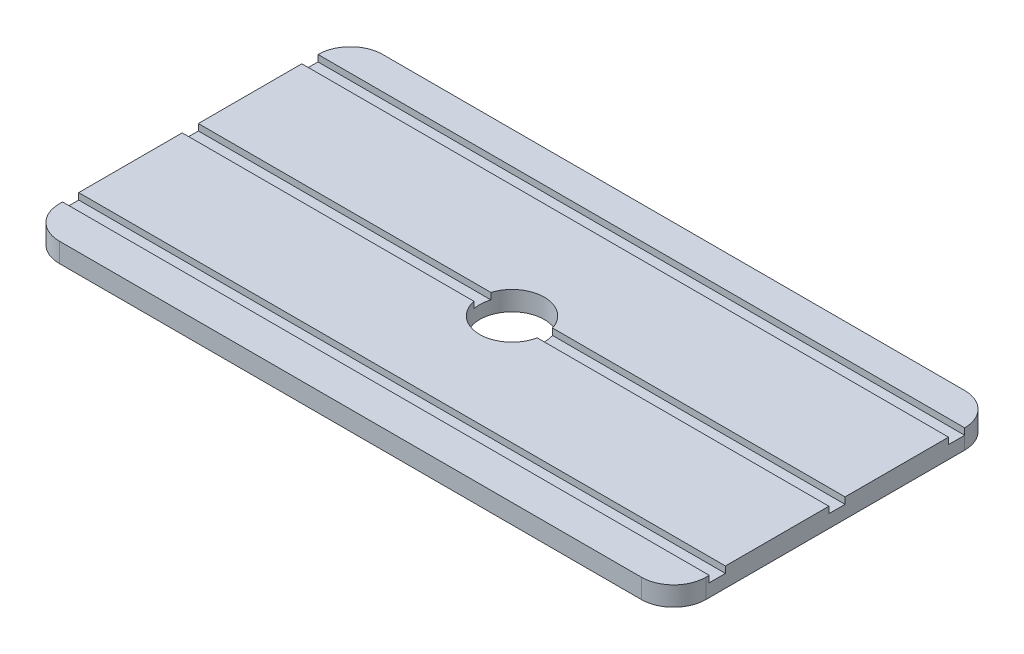
from build123d import *

# Parameters (mm, degrees)
SKETCH1_W           = 100
SKETCH1_H           = 50
BOSS_EXTRUDE1_DEPTH = 3
FILLET1_R           = 5
SKETCH2_R           = 5
CUT_EXTRUDE1_DEPTH  = 3
SKETCH4_W           = 100
SKETCH4_H           = 2.5
CUT_EXTRUDE2_DEPTH  = 1


with BuildPart() as part:
    # Sketch1 → Boss-Extrude1 (new body)
    with BuildSketch(Plane(origin=(0, 0, 0), x_dir=(1, 0, 0), z_dir=(0, 1, 0))):
        Rectangle(SKETCH1_W, SKETCH1_H)
    extrude(amount=BOSS_EXTRUDE1_DEPTH)

    # Fillet1
    fillet1_edges = [part.edges().sort_by_distance(p)[0] for p in [
        (-50, 1.5, -25),
        (50, 1.5, -25),
        (50, 1.5, 25),
        (-50, 1.5, 25),
    ]]
    fillet(fillet1_edges, radius=FILLET1_R)

    # Sketch2 → Cut-Extrude1 (cut)
    with BuildSketch(Plane(origin=(0, 3, 0), x_dir=(1, 0, 0), z_dir=(0, 1, 0))):
        with Locations(Location((0, 0, 0), (0, 0, 270))):
            Circle(SKETCH2_R)
    extrude(amount=-CUT_EXTRUDE1_DEPTH, mode=Mode.SUBTRACT)

    # Sketch4 → Cut-Extrude2 (cut)
    with BuildSketch(Plane(origin=(0, 3, 0), x_dir=(1, 0, 0), z_dir=(0, 1, 0))):
        with Locations((0, 18.75)):
            Rectangle(SKETCH4_W, SKETCH4_H)
        with BuildLine():
            Line((-4.769696007, 1.5), (-50, 1.5))
            Line((-50, 1.5), (-50, -1))
            Line((-50, -1), (-4.898979486, -1))
            ThreePointArc((-4.898979486, -1), (-4.993327693, 0.258221909), (-4.769696007, 1.5))
        make_face()
        with BuildLine():
            Line((50, -1), (50, 1.5))
            Line((50, 1.5), (4.769696007, 1.5))
            ThreePointArc((4.769696007, 1.5), (4.942088629, 0.758788496), (5, 0))
            ThreePointArc((5, 0), (4.974680765, -0.50254481), (4.898979486, -1))
            Line((4.898979486, -1), (50, -1))
        make_face()
        with Locations((0, -18.25)):
            Rectangle(SKETCH4_W, SKETCH4_H)
    extrude(amount=-CUT_EXTRUDE2_DEPTH, mode=Mode.SUBTRACT)


solid = part.part
